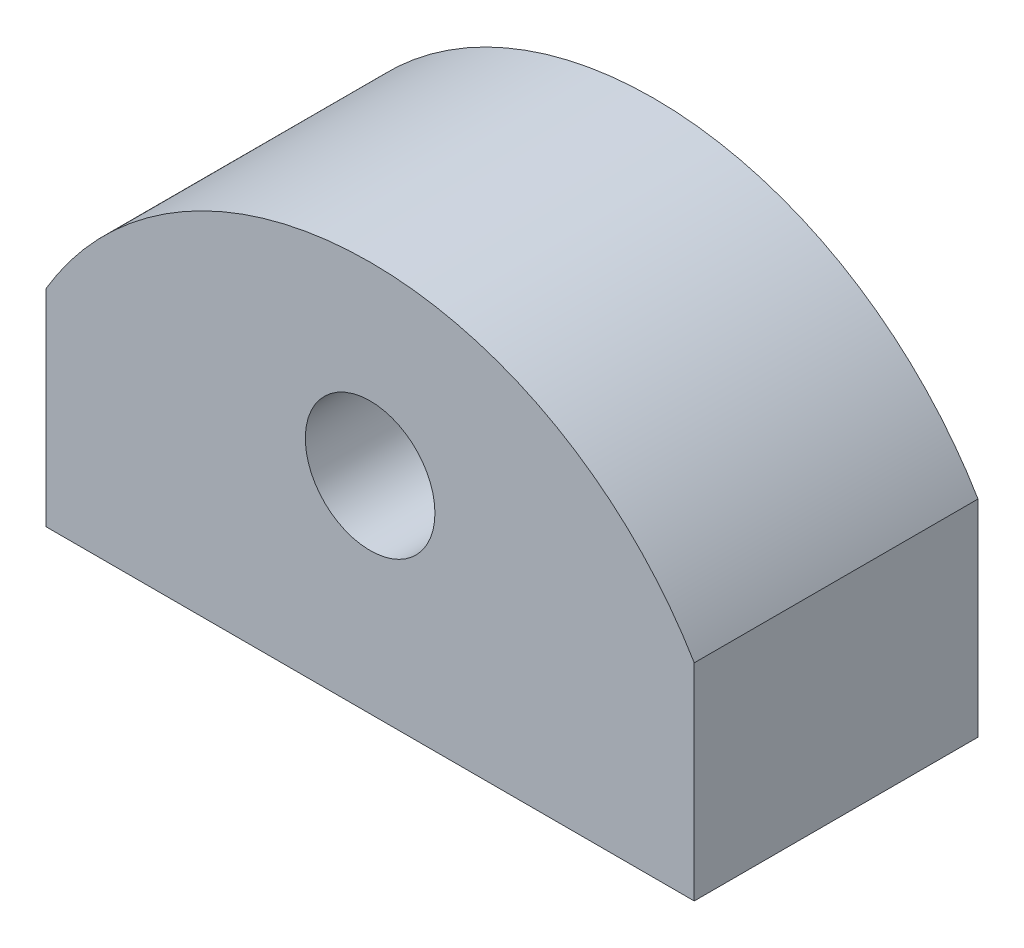
from build123d import *

# Parameters (mm, degrees)
EXTRUDE_3_8_DEPTH = 9.63
SKETCH2_R         = 2.2
M5_DRILL_DEPTH    = 9.63
SKETCH3_R         = 1.75
M4_DRILL_DEPTH    = 8


with BuildPart() as part:
    # Sketch1 → 3/8 (new body)
    with BuildSketch(Plane.XY):
        with BuildLine():
            Line((-11, 3.5), (-11, -3.5))
            Line((-11, -3.5), (11, -3.5))
            Line((11, -3.5), (11, 3.5))
            ThreePointArc((11, 3.5), (0, 9.776932339), (-11, 3.5))
        make_face()
    extrude(amount=EXTRUDE_3_8_DEPTH)

    # Sketch2 → M5_DRILL (cut)
    with BuildSketch(Plane.XY.offset(9.63)):
        with Locations((0, 3.5)):
            Circle(SKETCH2_R)
    extrude(amount=-M5_DRILL_DEPTH, mode=Mode.SUBTRACT)

    # Sketch3 → M4_DRILL (cut)
    with BuildSketch(Plane.XZ.offset(3.5)):
        with Locations(Location((-6, 4.815, 0), (0, 0, 270))):
            Circle(SKETCH3_R)
        with Locations(Location((6, 4.815, 0), (0, 0, 90))):
            Circle(SKETCH3_R)
    extrude(amount=-M4_DRILL_DEPTH, mode=Mode.SUBTRACT)


solid = part.part
